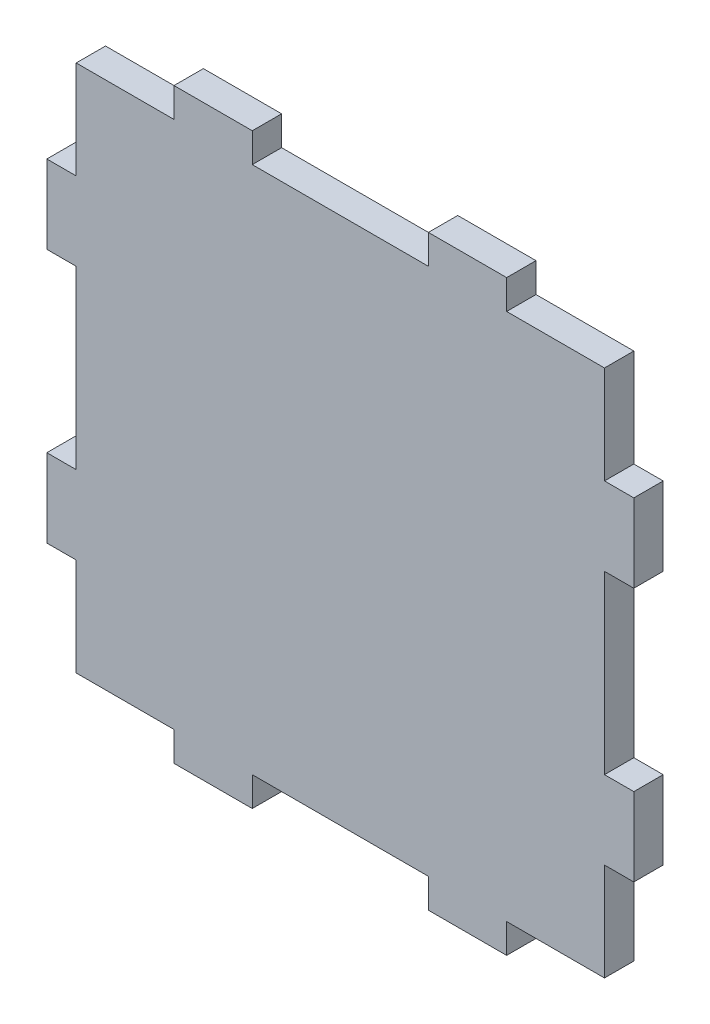
from build123d import *

# Parameters (mm, degrees)
BOSS_EXTRUDE1_DEPTH = 9.525


with BuildPart() as part:
    # Sketch1 → Boss-Extrude1 (new body)
    with BuildSketch(Plane.XY):
        Polygon((119.558532934, 186.570359281), (144.958532934, 186.570359281), (144.958532934, 177.045359281), (176.708532934, 177.045359281), (176.708532934, 145.295359281), (186.233532934, 145.295359281), (186.233532934, 119.895359281), (176.708532934, 119.895359281), (176.708532934, 62.745359281), (186.233532934, 62.745359281), (186.233532934, 37.345359281), (176.708532934, 37.345359281), (176.708532934, 5.595359281), (144.958532934, 5.595359281), (144.958532934, -3.929640719), (119.558532934, -3.929640719), (119.558532934, 5.595359281), (62.408532934, 5.595359281), (62.408532934, -3.929640719), (37.008532934, -3.929640719), (37.008532934, 5.595359281), (5.258532934, 5.595359281), (5.258532934, 37.345359281), (-4.266467066, 37.345359281), (-4.266467066, 62.745359281), (5.258532934, 62.745359281), (5.258532934, 119.895359281), (-4.266467066, 119.895359281), (-4.266467066, 145.295359281), (5.258532934, 145.295359281), (5.258532934, 177.045359281), (37.008532934, 177.045359281), (37.008532934, 186.570359281), (62.408532934, 186.570359281), (62.408532934, 177.045359281), (119.558532934, 177.045359281), align=None)
    extrude(amount=BOSS_EXTRUDE1_DEPTH)


solid = part.part
